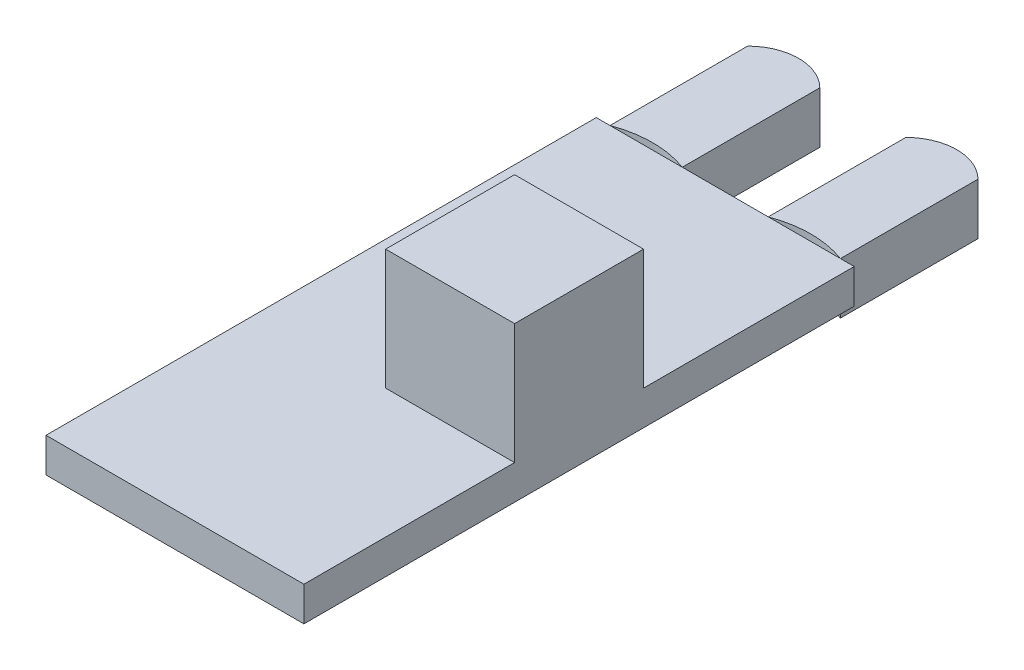
from build123d import *

# Parameters (mm, degrees)
SKETCH1_W             = 15
SKETCH1_H             = 32
BOSS_EXTRUDE1_DEPTH   = 2
SKETCH2_W             = 7.5
SKETCH2_H             = 7.5
BOSS_EXTRUDE2_DEPTH   = 7
BOSS_EXTRUDE3_DEPTH   = 3
BOSS_EXTRUDE3_2_DEPTH = 3


with BuildPart() as part:
    # Sketch1 → Boss-Extrude1 (new body)
    with BuildSketch(Plane(origin=(0, 0, 0), x_dir=(1, 0, 0), z_dir=(0, 1, 0))):
        Rectangle(SKETCH1_W, SKETCH1_H)
    extrude(amount=BOSS_EXTRUDE1_DEPTH)

    # Sketch2 → Boss-Extrude2 (add)
    with BuildSketch(Plane(origin=(0, 2, 0), x_dir=(1, 0, 0), z_dir=(0, 1, 0))):
        with Locations((3.75, 0)):
            Rectangle(SKETCH2_W, SKETCH2_H)
    extrude(amount=BOSS_EXTRUDE2_DEPTH)


with BuildPart() as body_2:
    # Sketch6 → Boss-Extrude3 (new body)
    with BuildSketch(Plane(origin=(0, 2, 0), x_dir=(1, 0, 0), z_dir=(0, 1, 0))):
        with BuildLine():
            Line((-6.7, 16), (-6.7, 24))
            ThreePointArc((-6.7, 24), (-4.6, 24.869848481), (-2.5, 24))
            Line((-2.5, 24), (-2.5, 16))
            ThreePointArc((-2.5, 16), (-4.6, 16.379501801), (-6.7, 16))
        make_face()
    extrude(amount=-BOSS_EXTRUDE3_DEPTH)


with BuildPart() as body_3:
    # Sketch6 → Boss-Extrude3 2 (new body)
    with BuildSketch(Plane(origin=(0, 2, 0), x_dir=(1, 0, 0), z_dir=(0, 1, 0))):
        with BuildLine():
            Line((2.5, 16), (2.5, 24))
            ThreePointArc((2.5, 24), (4.6, 24.869848481), (6.7, 24))
            Line((6.7, 24), (6.7, 16))
            ThreePointArc((6.7, 16), (4.6, 16.379501801), (2.5, 16))
        make_face()
    extrude(amount=-BOSS_EXTRUDE3_2_DEPTH)


solid = Compound([part.part, body_2.part, body_3.part])
